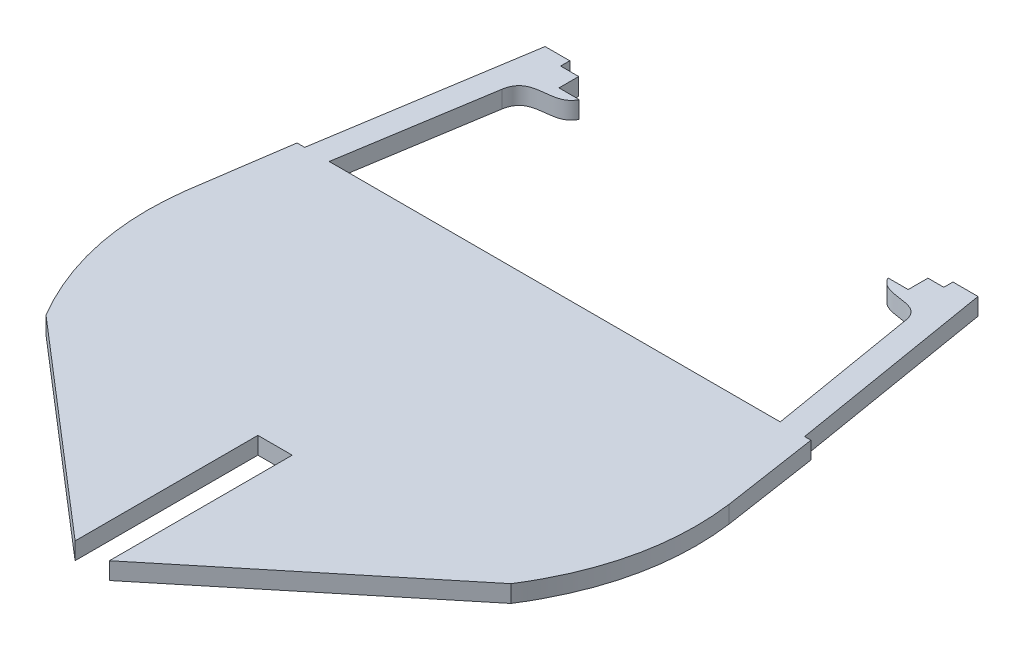
from build123d import *

# Parameters (mm, degrees)
EXTRUDE_2_DEPTH = 4


with BuildPart() as part:
    # 草图1 → 凸台-拉伸2 (new body)
    with BuildSketch(Plane(origin=(0, 0, 0), x_dir=(1, 0, 0), z_dir=(0, 1, 0))):
        with BuildLine():
            Line((-7.493646731, 0), (-10.814865867, -22.617855932))
            add(Edge.make_bspline(
                [(-10.814865867, -22.617855932), (-13.583142705, -44.426344102), (-1.98899974, -64.01075601)],
                knots=[0, 0, 0, 1, 1, 1], degree=2))
            Line((-1.98899974, -64.01075601), (46.968083593, -106.186589343))
            Line((46.968083593, -106.186589343), (46.968083593, -63.586589343))
            Line((46.968083593, -63.586589343), (54.968083593, -63.586589343))
            Line((54.968083593, -63.586589343), (54.968083593, -106.186589343))
            Line((54.968083593, -106.186589343), (106.410598372, -64.01075601))
            add(Edge.make_bspline(
                [(115.792042318, -22.617855932), (118.672533556, -44.533714829), (106.410598372, -64.01075601)],
                knots=[0, 0, 0, 1, 1, 1], degree=2))
            Line((115.792042318, -22.617855932), (112.396356875, -0.121439872))
            Line((112.396356875, -0.121439872), (110.919371618, -0.121439872))
            Line((110.919371618, -0.121439872), (102.847231691, 48.365226521))
            Line((102.847231691, 48.365226521), (97.014954375, 48.365226521))
            Line((97.014954375, 48.365226521), (97.014954375, 46.231466528))
            Line((97.014954375, 46.231466528), (93.316437053, 46.231466528))
            Line((93.316437053, 46.231466528), (93.316437053, 41.625642308))
            Line((93.316437053, 41.625642308), (88.622165067, 41.625642308))
            add(Edge.make_bspline(
                [(88.622165067, 41.625642308), (91.029256543, 36.904254059), (98.571856956, 41.17808537), (99.290965035, 34.709162562)],
                knots=[0, 0, 0, 0, 1, 1, 1, 1], degree=3))
            Line((99.290965035, 34.709162562), (105.12324235, 0))
            Line((105.12324235, 0), (0, 0))
            Line((0, 0), (5.547775983, 34.709162562))
            add(Edge.make_bspline(
                [(16.649061602, 41.625642308), (14.296406024, 36.889271563), (6.70760812, 41.39847379), (5.547775983, 34.709162562)],
                knots=[0, 0, 0, 0, 1, 1, 1, 1], degree=3))
            Line((16.649061602, 41.625642308), (11.922711294, 41.625642308))
            Line((11.922711294, 41.625642308), (11.922711294, 46.231466528))
            Line((11.922711294, 46.231466528), (7.707317775, 46.231466528))
            Line((7.707317775, 46.231466528), (7.707317775, 48.365226521))
            Line((7.707317775, 48.365226521), (1.959053886, 48.365226521))
            Line((1.959053886, 48.365226521), (-5.705297966, 0))
            Line((-5.705297966, 0), (-7.493646731, 0))
        make_face()
    extrude(amount=EXTRUDE_2_DEPTH)


solid = part.part
